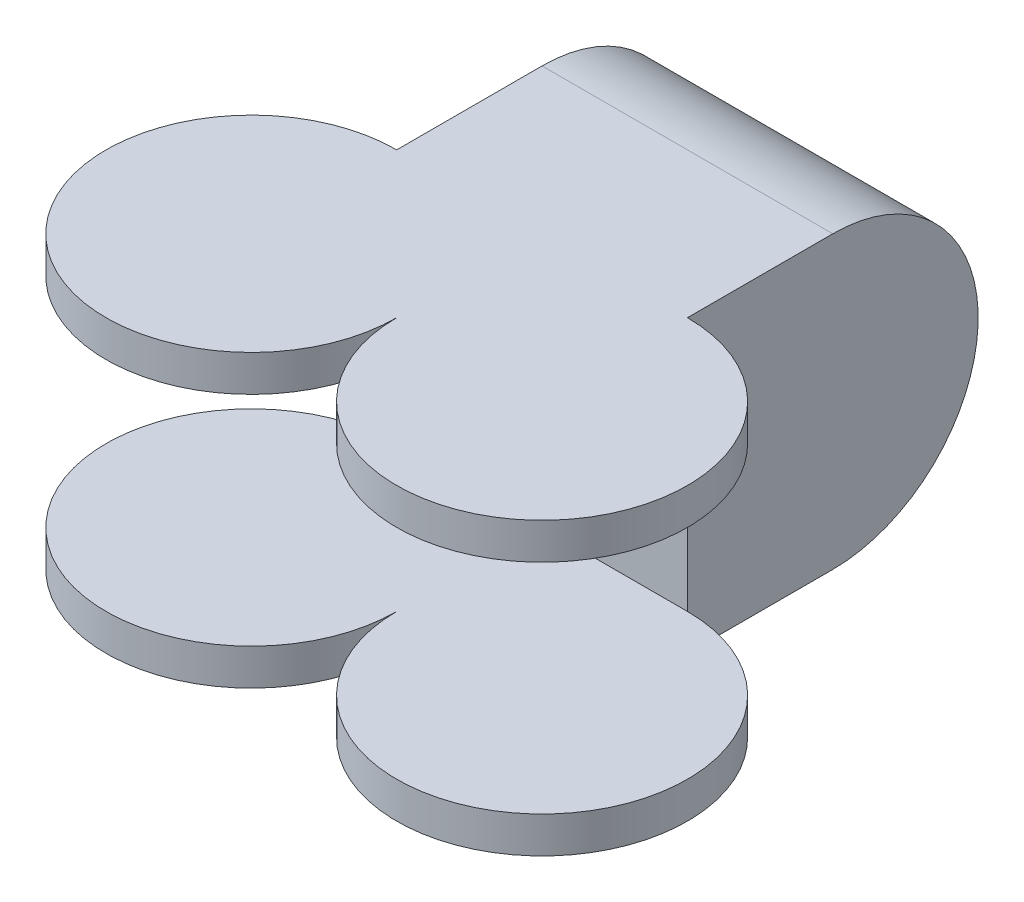
from build123d import *

# Parameters (mm, degrees)
BOSS_EXTRUDE1_DEPTH = 80
BOSS_EXTRUDE2_DEPTH = 80
SKETCH3_W           = 80
SKETCH3_H           = 60
CUT_EXTRUDE1_DEPTH  = 133


with BuildPart() as part:
    # Sketch1 → Boss-Extrude1 (new body)
    with BuildSketch(Plane(origin=(0, 0, 0), x_dir=(0, 0, -1), z_dir=(1, 0, 0))):
        with BuildLine():
            Line((0, 40), (-80, 40))
            Line((-80, 40), (-80, -40))
            Line((-80, -40), (0, -40))
            ThreePointArc((0, -40), (40, 0), (0, 40))
        make_face()
    extrude(amount=BOSS_EXTRUDE1_DEPTH)

    # Sketch2 → Boss-Extrude2 (add)
    with BuildSketch(Plane(origin=(0, 40, 0), x_dir=(1, 0, 0), z_dir=(0, 1, 0))):
        with BuildLine():
            Line((0, -80), (40, -80))
            ThreePointArc((40, -80), (28.284271247, -51.715728753), (0, -40))
            Line((0, -40), (0, -80))
        make_face()
        with BuildLine():
            ThreePointArc((0, -40), (-28.284271247, -108.284271247), (40, -80))
            Line((40, -80), (0, -80))
            Line((0, -80), (0, -40))
        make_face()
        with BuildLine():
            Line((80, -80), (40, -80))
            ThreePointArc((40, -80), (80, -120), (120, -80))
            ThreePointArc((120, -80), (108.284271247, -51.715728753), (80, -40))
            Line((80, -40), (80, -80))
        make_face()
        with BuildLine():
            ThreePointArc((80, -40), (51.715728753, -51.715728753), (40, -80))
            Line((40, -80), (80, -80))
            Line((80, -80), (80, -40))
        make_face()
    extrude(amount=-BOSS_EXTRUDE2_DEPTH)

    # Sketch3 → Cut-Extrude1 (cut, symmetric)
    with BuildSketch(Plane(origin=(80, 0, 0), x_dir=(0, 0, -1), z_dir=(1, 0, 0))):
        with Locations((-80, 0)):
            Rectangle(SKETCH3_W, SKETCH3_H)
    extrude(amount=CUT_EXTRUDE1_DEPTH, both=True, mode=Mode.SUBTRACT)


solid = part.part
